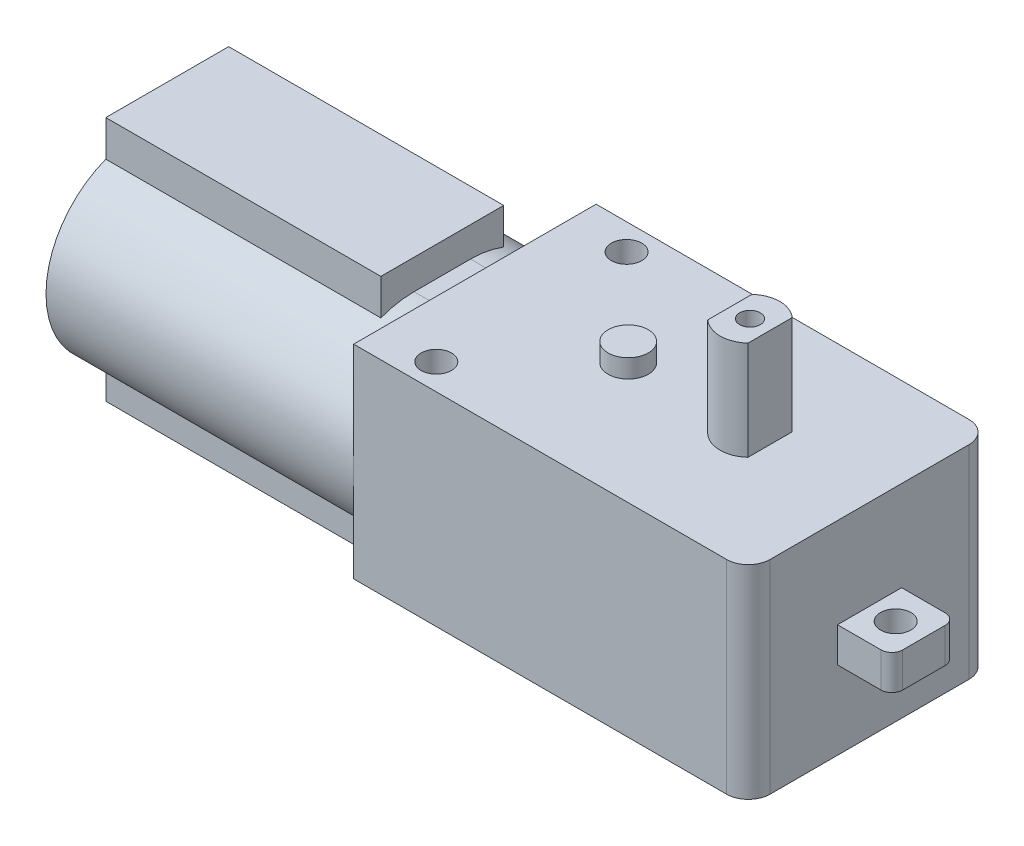
from build123d import *

# Parameters (mm, degrees)
SKETCH1_R           = 1.4
BOSS_EXTRUDE1_DEPTH = 18.7
SKETCH2_R           = 0.95
BOSS_EXTRUDE2_DEPTH = 9.1
SKETCH3_R           = 1.85
BOSS_EXTRUDE3_DEPTH = 1.7
SKETCH4_R           = 1.4
BOSS_EXTRUDE4_DEPTH = 3.2
BOSS_EXTRUDE5_DEPTH = 28.3
SKETCH7_W           = 11.3
SKETCH7_H           = 22.6
BOSS_EXTRUDE6_DEPTH = 25.3


with BuildPart() as part:
    # Sketch1 → Boss-Extrude1 (new body)
    with BuildSketch(Plane(origin=(0, 0, 0), x_dir=(1, 0, 0), z_dir=(0, 1, 0))):
        with BuildLine():
            Line((-25.3, 11.15), (9, 11.15))
            ThreePointArc((9, 11.15), (10.414213562, 10.564213562), (11, 9.15))
            Line((11, 9.15), (11, -9.15))
            ThreePointArc((11, -9.15), (10.414213562, -10.564213562), (9, -11.15))
            Line((9, -11.15), (-25.3, -11.15))
            Line((-25.3, -11.15), (-25.3, 11.15))
        make_face()
        with Locations(Location((-20.1, 8.75, 0), (0, 0, 270))):
            Circle(SKETCH1_R, mode=Mode.SUBTRACT)
        with Locations(Location((-20.1, -8.75, 0), (0, 0, 270))):
            Circle(SKETCH1_R, mode=Mode.SUBTRACT)
    extrude(amount=BOSS_EXTRUDE1_DEPTH)

    # Sketch2 → Boss-Extrude2 (add)
    with BuildSketch(Plane(origin=(0, 18.7, 0), x_dir=(1, 0, 0), z_dir=(0, 1, 0))):
        with BuildLine():
            ThreePointArc((1.85, 2.034698995), (0, 2.75), (-1.85, 2.034698995))
            Line((-1.85, 2.034698995), (-1.85, -2.034698995))
            ThreePointArc((-1.85, -2.034698995), (0, -2.75), (1.85, -2.034698995))
            Line((1.85, -2.034698995), (1.85, 2.034698995))
        make_face()
        with Locations(Location((0, 0, 0), (0, 0, 270))):
            Circle(SKETCH2_R, mode=Mode.SUBTRACT)
    extrude(amount=BOSS_EXTRUDE2_DEPTH)

    # Sketch3 → Boss-Extrude3 (add)
    with BuildSketch(Plane(origin=(0, 18.7, 0), x_dir=(1, 0, 0), z_dir=(0, 1, 0))):
        with Locations(Location((-11.2, 0, 0), (0, 0, 270))):
            Circle(SKETCH3_R)
    extrude(amount=BOSS_EXTRUDE3_DEPTH)

    # Sketch4 → Boss-Extrude4 (add)
    with BuildSketch(Plane(origin=(0, 7.2, 0), x_dir=(-1, 0, 0), z_dir=(0, -1, 0))):
        with BuildLine():
            Line((-11, -2.95), (-15, -2.95))
            ThreePointArc((-15, -2.95), (-15.707106781, -2.657106781), (-16, -1.95))
            Line((-16, -1.95), (-16, 1.95))
            ThreePointArc((-16, 1.95), (-15.707106781, 2.657106781), (-15, 2.95))
            Line((-15, 2.95), (-11, 2.95))
            Line((-11, 2.95), (-11, -2.95))
        make_face()
        with Locations(Location((-13.4, 0, 0), (0, 0, 90))):
            Circle(SKETCH4_R, mode=Mode.SUBTRACT)
    extrude(amount=-BOSS_EXTRUDE4_DEPTH)

    # Sketch5 → Boss-Extrude5 (add)
    with BuildSketch(Plane.ZY.offset(25.3)):
        with BuildLine():
            Line((-2.6, 17.1), (2.6, 17.1))
            ThreePointArc((2.6, 17.1), (11.15, 8.55), (2.6, 0))
            Line((2.6, 0), (-2.6, 0))
            ThreePointArc((-2.6, 0), (-11.15, 8.55), (-2.6, 17.1))
        make_face()
    extrude(amount=BOSS_EXTRUDE5_DEPTH)

    # Sketch7 → Boss-Extrude6 (add)
    with BuildSketch(Plane.ZY.offset(53.6)):
        with Locations((0, 8.55)):
            Rectangle(SKETCH7_W, SKETCH7_H)
    extrude(amount=-BOSS_EXTRUDE6_DEPTH)


solid = part.part
